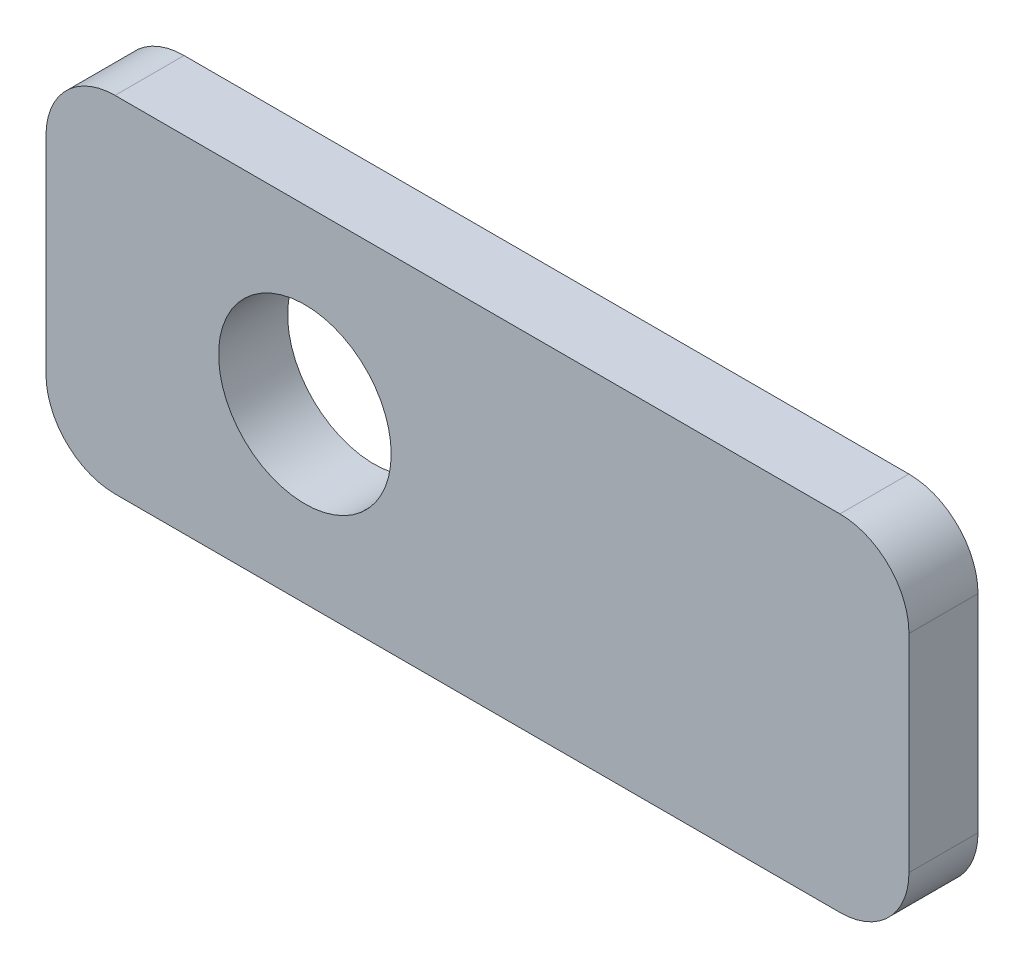
from build123d import *

# Parameters (mm, degrees)
SKETCH1_R           = 3.175
BOSS_EXTRUDE1_DEPTH = 2.54


with BuildPart() as part:
    # Sketch1 → Boss-Extrude1 (new body)
    with BuildSketch(Plane.XY):
        with BuildLine():
            Line((2.54, 0), (29.21, 0))
            ThreePointArc((29.21, 0), (31.006051224, 0.743948776), (31.75, 2.54))
            Line((31.75, 2.54), (31.75, 10.16))
            ThreePointArc((31.75, 10.16), (31.006051224, 11.956051224), (29.21, 12.7))
            Line((29.21, 12.7), (2.54, 12.7))
            ThreePointArc((2.54, 12.7), (0.743948776, 11.956051224), (0, 10.16))
            Line((0, 10.16), (0, 2.54))
            ThreePointArc((0, 2.54), (0.743948776, 0.743948776), (2.54, 0))
        make_face()
        with Locations((9.525, 6.35)):
            Circle(SKETCH1_R, mode=Mode.SUBTRACT)
    extrude(amount=BOSS_EXTRUDE1_DEPTH)


solid = part.part
